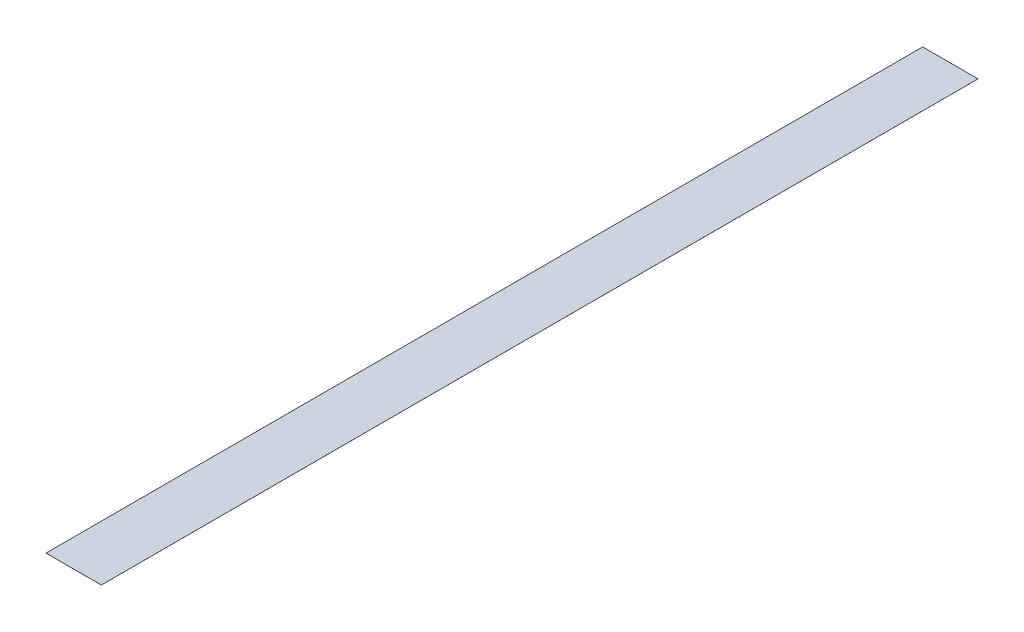
from build123d import *

# Parameters (mm, degrees)
ESBO_O1_W                = 18.934391243
ESBO_O1_H                = 300
RESSALTO_EXTRUS_O9_DEPTH = 0.01


with BuildPart() as part:
    # Esboço1 → Ressalto-extrusão9 (new body)
    with BuildSketch(Plane(origin=(0, 0, 0), x_dir=(1, 0, 0), z_dir=(0, 1, 0))):
        with Locations((568.247734453, 899.272557951)):
            Rectangle(ESBO_O1_W, ESBO_O1_H)
    extrude(amount=RESSALTO_EXTRUS_O9_DEPTH)


solid = part.part
